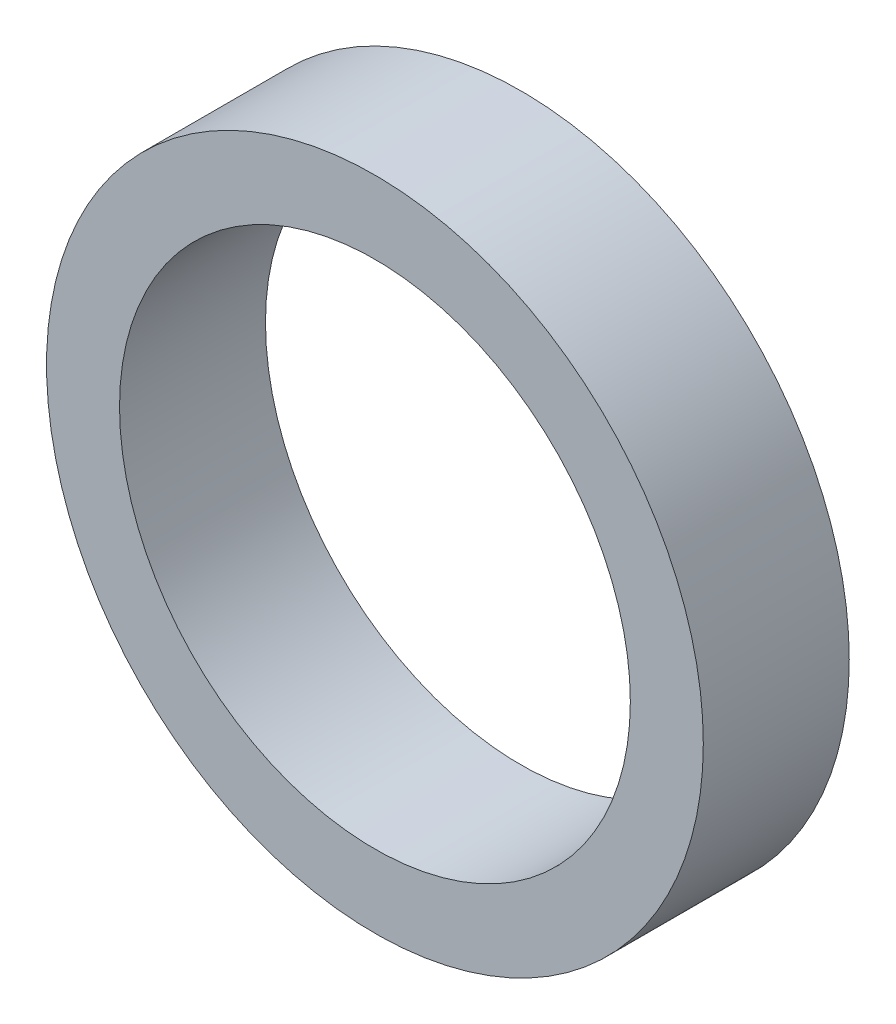
from build123d import *

# Parameters (mm, degrees)
ESQUISSE1_R        = 22.5
ESQUISSE1_R_2      = 17.5
BOSS_EXTRU_1_DEPTH = 10


with BuildPart() as part:
    # Esquisse1 → Boss.-Extru.1 (new body)
    with BuildSketch(Plane.XY):
        Circle(ESQUISSE1_R)
        Circle(ESQUISSE1_R_2, mode=Mode.SUBTRACT)
    extrude(amount=BOSS_EXTRU_1_DEPTH)


solid = part.part
